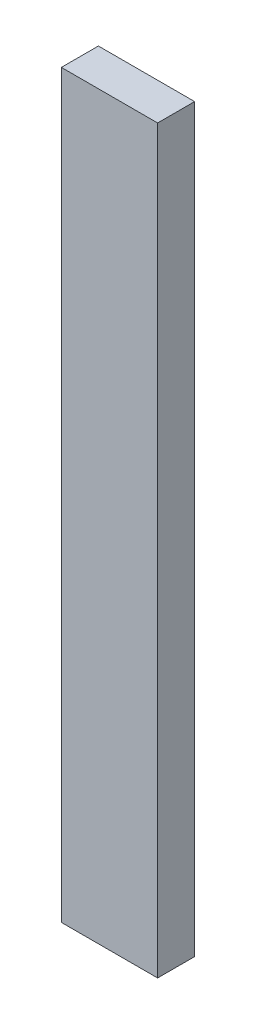
from build123d import *

# Parameters (mm, degrees)
SKETCH1_W           = 260
SKETCH1_H           = 2000
BOSS_EXTRUDE1_DEPTH = 100


with BuildPart() as part:
    # Sketch1 → Boss-Extrude1 (new body)
    with BuildSketch(Plane.XY):
        with Locations((130, 1000)):
            Rectangle(SKETCH1_W, SKETCH1_H)
    extrude(amount=BOSS_EXTRUDE1_DEPTH)


solid = part.part
